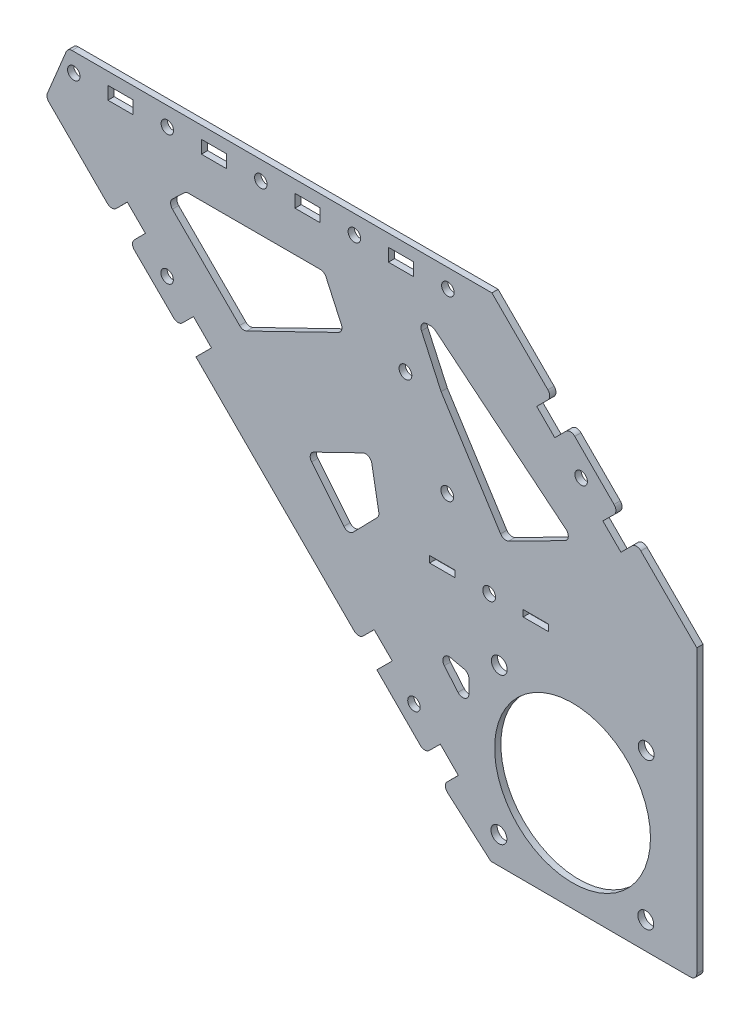
from build123d import *

# Parameters (mm, degrees)
SKETCH_1_R      = 2
SKETCH_1_R_2    = 25
SKETCH_1_R_3    = 2.05
SKETCH_1_R_4    = 2.55
SKETCH_1_W      = 8.1
SKETCH_1_H      = 4.13
SKETCH_1_W_2    = 8.2
SKETCH_1_H_2    = 2.1
EXTRUDE_1_DEPTH = 2
FILLET_2_R      = 2


with BuildPart() as part:
    # 草图1 → 凸台-拉伸1 (new body)
    with BuildSketch(Plane.XY):
        Polygon((7.045333707, -5.153917555), (20.793199876, -17.15268299), (73.209787659, -17.315490317), (86.900465187, -17.315490317), (86.900465187, 75.181701178), (67.533287282, 94.548879082), (64.033108715, 91.048700515), (62.548184475, 89.563776275), (56.749908869, 95.362051881), (58.234833109, 96.846976121), (61.771734574, 100.31043179), (54.027552903, 108.054613461), (46.320094131, 115.762072234), (42.819915564, 112.261893667), (41.334991323, 110.776969426), (35.536715718, 116.575245032), (37.021639958, 118.060169273), (40.521818525, 121.560347839), (21.15464062, 140.927525744), (-114.884210676, 140.927525744), (-121.955278488, 123.856457932), (-100.778610768, 102.679790212), (-97.299097838, 106.179996932), (-95.818582675, 107.669317198), (-90.003141638, 101.888257991), (-91.483656801, 100.398937726), (-94.97172112, 96.890128759), (-87.254003865, 89.218039899), (-79.525883533, 81.535609468), (-76.073106039, 84.988386963), (-74.583785773, 86.468902126), (-68.802726567, 80.653461089), (-70.292046832, 79.172945926), (-73.790498852, 75.674493907), (-21.601590364, 23.48558542), (-18.103138345, 26.984037439), (-16.622623182, 28.473357705), (-10.807182146, 22.692298498), (-12.287697308, 21.202978233), (-15.740474803, 17.750200738), (-8.058044372, 10.022080406), (-0.385955513, 2.304363151), (3.122853454, 5.79242747), (4.61217372, 7.272942633), (10.393232926, 1.457501596), (8.903912661, -0.023013566), (5.403705941, -3.502526497), align=None)
        with Locations((-52.972571837, 134.927525744)):
            Circle(SKETCH_1_R, mode=Mode.SUBTRACT)
        with Locations((47.027428163, 14.927525744)):
            Circle(SKETCH_1_R_2, mode=Mode.SUBTRACT)
        with Locations(Location((-22.972571837, 134.927525744, 0), (0, 0, 180))):
            Circle(SKETCH_1_R, mode=Mode.SUBTRACT)
        with Locations((7.027428163, 134.927525744)):
            Circle(SKETCH_1_R, mode=Mode.SUBTRACT)
        with Locations(Location((-112.972571837, 134.927525744, 0), (0, 0, 180))):
            Circle(SKETCH_1_R, mode=Mode.SUBTRACT)
        with Locations((-82.972571837, 134.927525744)):
            Circle(SKETCH_1_R, mode=Mode.SUBTRACT)
        with Locations((49.784912216, 103.811972774)):
            Circle(SKETCH_1_R, mode=Mode.SUBTRACT)
        with Locations((-83.04451802, 93.427525744)):
            Circle(SKETCH_1_R, mode=Mode.SUBTRACT)
        with Locations((20.275835807, 56.927525744)):
            Circle(SKETCH_1_R_3, mode=Mode.SUBTRACT)
        with Locations((70.527428163, -8.572474256)):
            Circle(SKETCH_1_R_4, mode=Mode.SUBTRACT)
        with Locations((23.400215706, -8.445261799)):
            Circle(SKETCH_1_R_4, mode=Mode.SUBTRACT)
        with Locations((23.527428163, 38.681950658)):
            Circle(SKETCH_1_R_4, mode=Mode.SUBTRACT)
        with Locations((70.65464062, 38.554738201)):
            Circle(SKETCH_1_R_4, mode=Mode.SUBTRACT)
        with Locations((6.845259268, 78.01353091)):
            Circle(SKETCH_1_R_3, mode=Mode.SUBTRACT)
        with Locations(Location((-3.848558527, 14.231566251, 0), (0, 0, 180))):
            Circle(SKETCH_1_R, mode=Mode.SUBTRACT)
        with Locations((-6.58531727, 105.099536075)):
            Circle(SKETCH_1_R_3, mode=Mode.SUBTRACT)
        with Locations((-37.972571837, 134.927525744)):
            Rectangle(SKETCH_1_W, SKETCH_1_H, mode=Mode.SUBTRACT)
        with Locations((-7.972571837, 134.927525744)):
            Rectangle(SKETCH_1_W, SKETCH_1_H, mode=Mode.SUBTRACT)
        with Locations((-97.972571837, 134.927525744)):
            Rectangle(SKETCH_1_W, SKETCH_1_H, mode=Mode.SUBTRACT)
        with Locations((-67.972571837, 134.927525744)):
            Rectangle(SKETCH_1_W, SKETCH_1_H, mode=Mode.SUBTRACT)
        with Locations((5.275835807, 56.927525744)):
            Rectangle(SKETCH_1_W_2, SKETCH_1_H_2, mode=Mode.SUBTRACT)
        with Locations((35.275835807, 56.927525744)):
            Rectangle(SKETCH_1_W_2, SKETCH_1_H_2, mode=Mode.SUBTRACT)
        Polygon((-26.317798475, 106.178700743), (-58.783300448, 90.379511607), (-82.786741677, 114.382952836), (-76.96930946, 119.927525744), (-32.606331473, 119.927525744), align=None, mode=Mode.SUBTRACT)
        Polygon((47.310357667, 85.180238498), (24.91351613, 73.844882053), (4.862626833, 105.32477825), (-2.731253041, 121.927525744), (2.38765218, 121.927525744), align=None, mode=Mode.SUBTRACT)
        Polygon((-14.950211349, 60.812452014), (-17.845757969, 76.937806676), (-38.27290612, 66.997027771), (-24.925284185, 50.558567838), align=None, mode=Mode.SUBTRACT)
        Polygon((2.01437662, 34.262984309), (13.802642778, 20.368597473), (13.802642778, 31.617034086), align=None, mode=Mode.SUBTRACT)
    extrude(amount=EXTRUDE_1_DEPTH)

    # 圆角2
    fillet_2_edges = [part.edges().sort_by_distance(p)[0] for p in [
        (-26.317798475, 106.178700743, 1),
        (-32.606331473, 119.927525744, 1),
        (-76.96930946, 119.927525744, 1),
        (-82.786741677, 114.382952836, 1),
        (-58.783300448, 90.379511607, 1),
        (47.310357667, 85.180238498, 1),
        (2.38765218, 121.927525744, 1),
        (-2.731253041, 121.927525744, 1),
        (24.91351613, 73.844882053, 1),
        (-24.925284185, 50.558567838, 1),
        (-14.950211349, 60.812452014, 1),
        (-17.845757969, 76.937806676, 1),
        (-38.27290612, 66.997027771, 1),
        (13.802642778, 31.617034086, 1),
        (2.01437662, 34.262984309, 1),
        (13.802642778, 20.368597473, 1),
        (40.521818525, 121.560347839, 1),
        (46.320094131, 115.762072234, 1),
        (61.771734574, 100.31043179, 1),
        (67.533287282, 94.548879082, 1),
        (86.900465187, -17.315490317, 1),
        (5.403705941, -3.502526497, 1),
        (-0.385955513, 2.304363151, 1),
        (-21.601590364, 23.48558542, 1),
        (-79.525883533, 81.535609468, 1),
        (-94.97172112, 96.890128759, 1),
        (-100.778610768, 102.679790212, 1),
        (-121.955278488, 123.856457932, 1),
        (-114.884210676, 140.927525744, 1),
    ]]
    fillet(fillet_2_edges, radius=FILLET_2_R)


solid = part.part
